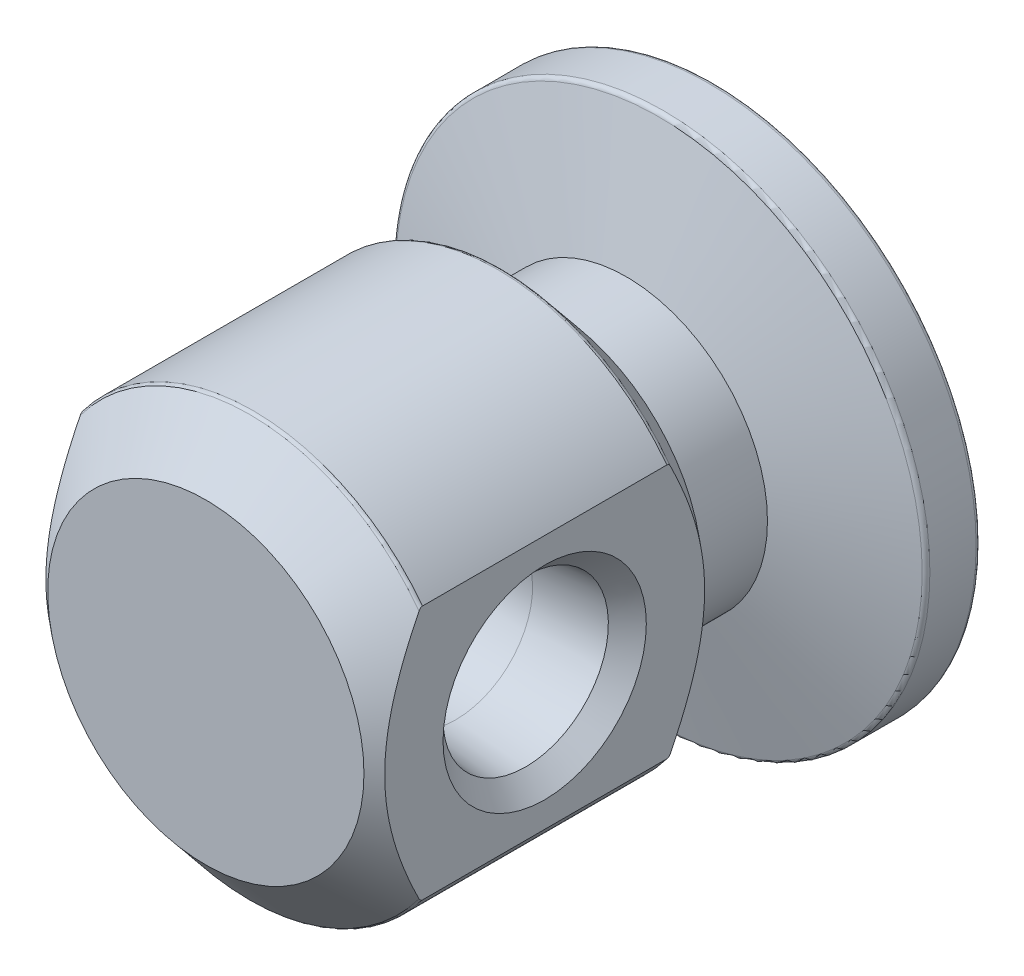
from build123d import *

# Parameters (mm, degrees)
BOSS_EXTRUDE1_DEPTH      = 12.7
BOSS_EXTRUDE1_DEPTH_BACK = 25.4
SKETCH4_R                = 15.875
CHAMFER1_SIZE            = 0.254
FILLET1_R                = 0.254
CIRPATTERN1_COUNT        = 2


with BuildPart() as part:
    # Sketch4 → Boss-Extrude1 (new, two sides: drawn at the far end of the back side and taken through both)
    with BuildSketch(Plane.XY.offset(-BOSS_EXTRUDE1_DEPTH_BACK)):
        Circle(SKETCH4_R)
    extrude(amount=BOSS_EXTRUDE1_DEPTH + BOSS_EXTRUDE1_DEPTH_BACK)

    # Sketch1 → Cut-Revolve2 (revolve, cut)
    with BuildSketch(Plane.ZY):
        Polygon((-16.256, 3.175), (3.175, 3.175), (5.082732465, 0), (-53.588062875, 0), (-53.588062875, 25.4), (15.265422121, 25.4), (15.265422121, 0), (9.525, 0), (9.525, 8.89), (6.988737455, 11.9126), (-6.988737455, 11.9126), (-9.668360117, 8.719150065), (-9.668360117, 7.9375), (-10.324242399, 7.9375), (-14.113360117, 7.9375), (-16.002, 14.986), (-19.05, 14.986), (-19.05, 8.636), (-16.256, 8.636), align=None)
    revolve(axis=Axis((0, 0, 24.527557732), (0, 0, -1)), mode=Mode.SUBTRACT)

    # Chamfer1
    chamfer1_edges = [part.edges().sort_by_distance(p)[0] for p in [
        (0, -8.636, -19.05),
    ]]
    chamfer(chamfer1_edges, length=CHAMFER1_SIZE)

    # Fillet1
    fillet1_edges = [part.edges().sort_by_distance(p)[0] for p in [
        (0, -11.9126, 6.988737455),
        (0, -11.9126, -6.988737455),
        (0, -14.986, -19.05),
        (0, -14.986, -16.002),
    ]]
    fillet(fillet1_edges, radius=FILLET1_R)

    # Sketch6 → Cut-Revolve3 (revolve, cut)
    with BuildSketch(Plane.XY):
        Polygon((-4.7752, 0), (22.225, 0), (22.225, -12.7), (9.525, -12.7), (9.525, -5.715), (8.4582, -4.6482), (4.538835065, -4.3053), (-2.188314777, -4.3053), align=None)
    cut_revolve3 = revolve(axis=Axis((22.225, 0, 0), (1, 0, 0)), mode=Mode.SUBTRACT)

    # CirPattern1: Cut-Revolve3 ×2 about axis
    cirpattern1_axis = Axis((0, 0, -23.67915), (0, 0, 1))
    for i in range(1, CIRPATTERN1_COUNT):
        add(cut_revolve3.rotate(cirpattern1_axis, i * 360 / CIRPATTERN1_COUNT), mode=Mode.SUBTRACT)


solid = part.part
